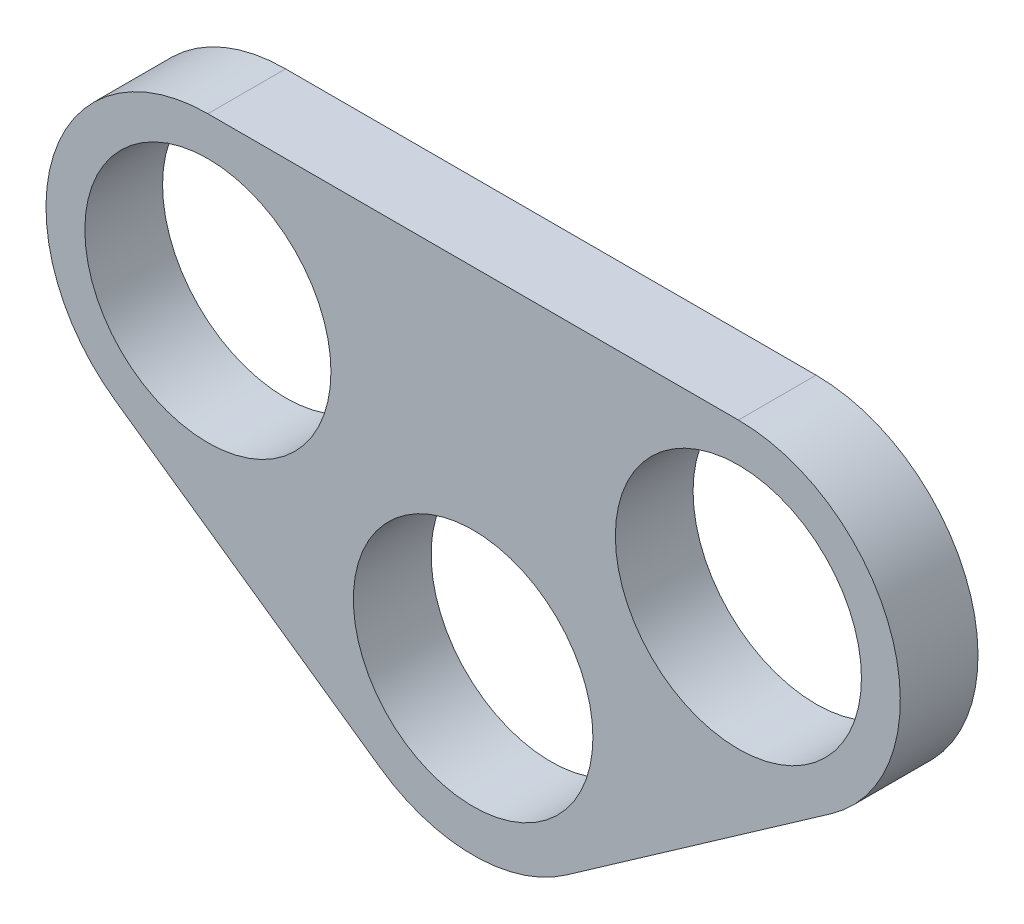
from build123d import *

# Parameters (mm, degrees)
CROQUIS1_R              = 12.5
CROQUIS1_R_2            = 9.247768435
CROQUIS1_R_3            = 9.5
SALIENTE_EXTRUIR1_DEPTH = 6


with BuildPart() as part:
    # Croquis1 → Saliente-Extruir1 (new body)
    # profile 1 of 6: a face of its own
    with BuildSketch(Plane.XY):
        with BuildLine():
            Line((20.478801107, 26.839410909), (-20.478801107, 26.839410909))
            ThreePointArc((-20.478801107, 26.839410909), (-11.639966342, 23.178245674), (-7.978801107, 14.339410909))
            ThreePointArc((-7.978801107, 14.339410909), (-8.557339261, 10.580588295), (-10.239400698, 7.169705249))
            ThreePointArc((-10.239400698, 7.169705249), (-6.8e-08, 12.5), (10.239400619, 7.169705361))
            ThreePointArc((10.239400619, 7.169705361), (9.391165666, 20.111268523), (20.478801107, 26.839410909))
        make_face()
    # profile 2 of 6: a face of its own
    with BuildSketch(Plane.XY):
        with BuildLine():
            ThreePointArc((-10.239400698, 7.169705249), (-18.30819901, 2.029313974), (-27.648506562, 4.100010355))
            Line((-27.648506562, 4.100010355), (-7.169705454, -10.239400554))
            ThreePointArc((-7.169705454, -10.239400554), (-12.310096891, -2.170602344), (-10.239400698, 7.169705249))
        make_face()
    # profile 3 of 6: a face of its own
    with BuildSketch(Plane.XY):
        with BuildLine():
            ThreePointArc((27.648506562, 4.100010355), (18.308198943, 2.029313986), (10.239400619, 7.169705361))
            ThreePointArc((10.239400619, 7.169705361), (11.921461902, 3.758822439), (12.5, 0))
            ThreePointArc((12.5, 0), (11.087635415, -5.771857665), (7.169705454, -10.239400554))
            Line((7.169705454, -10.239400554), (27.648506562, 4.100010355))
        make_face()
    # profile 4 of 6: a face of its own
    with BuildSketch(Plane.XY):
        Circle(CROQUIS1_R)
        Circle(CROQUIS1_R_2, mode=Mode.SUBTRACT)
    # profile 5 of 6: a face of its own
    with BuildSketch(Plane.XY):
        with Locations((-20.478801107, 14.339410909)):
            Circle(CROQUIS1_R)
        with Locations((-20.478801107, 14.339410909)):
            Circle(CROQUIS1_R_3, mode=Mode.SUBTRACT)
    # profile 6 of 6: a face of its own
    with BuildSketch(Plane.XY):
        with Locations((20.478801107, 14.339410909)):
            Circle(CROQUIS1_R)
        with Locations((20.478801107, 14.339410909)):
            Circle(CROQUIS1_R_3, mode=Mode.SUBTRACT)
    extrude(amount=SALIENTE_EXTRUIR1_DEPTH)


solid = part.part
